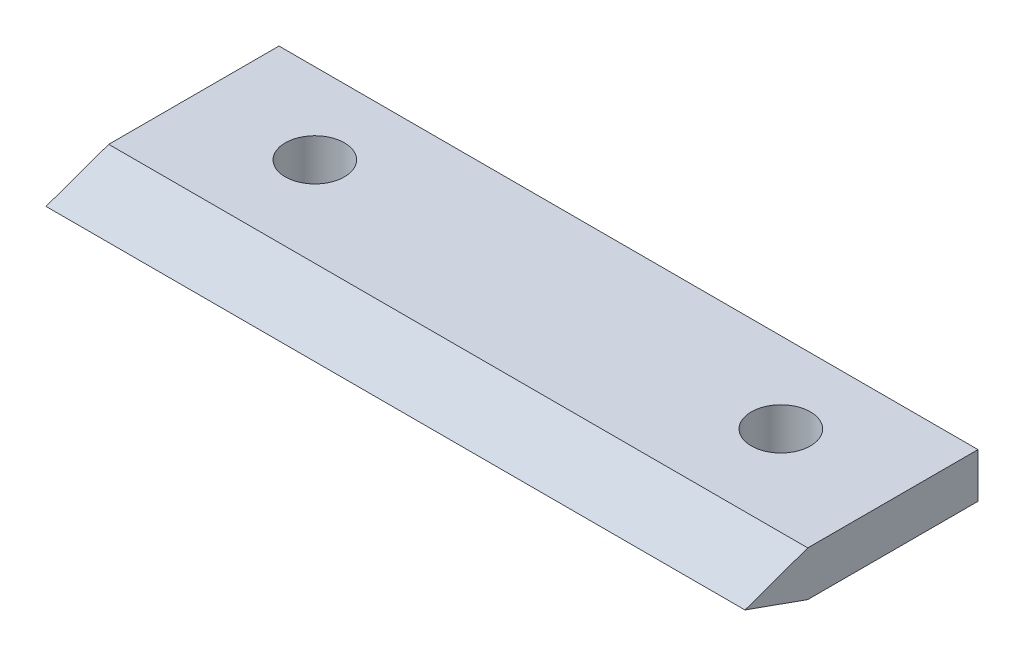
from build123d import *

# Parameters (mm, degrees)
SKETCH_1_W          = 39
SKETCH_1_H          = 13
SKETCH_1_R          = 1.65
EXTRUDE_1_DEPTH     = 2.5
CUT_EXTRUDE_1_DEPTH = 42
CUT_EXTRUDE_2_DEPTH = 42


with BuildPart() as part:
    # 草图1 → 凸台-拉伸1 (new body)
    with BuildSketch(Plane(origin=(0, 0, 0), x_dir=(1, 0, 0), z_dir=(0, 1, 0))):
        with Locations((19.5, 6.5)):
            Rectangle(SKETCH_1_W, SKETCH_1_H)
        with Locations(Location((6.5, 8.5, 0), (0, 0, 270))):
            Circle(SKETCH_1_R, mode=Mode.SUBTRACT)
        with Locations(Location((32.5, 8.5, 0), (0, 0, 270))):
            Circle(SKETCH_1_R, mode=Mode.SUBTRACT)
    extrude(amount=EXTRUDE_1_DEPTH)

    # 草图2 → 切除-拉伸1 (cut)
    with BuildSketch(Plane(origin=(39, 0, 0), x_dir=(0, 0, -1), z_dir=(1, 0, 0))):
        Polygon((3.5, 2.5), (0, 2.5), (0, 1.25), align=None)
    extrude(amount=-CUT_EXTRUDE_1_DEPTH, mode=Mode.SUBTRACT)

    # 草图3 → 切除-拉伸2 (cut)
    with BuildSketch(Plane(origin=(39, 0, 0), x_dir=(0, 0, -1), z_dir=(1, 0, 0))):
        Polygon((0, 1.25), (0, 0), (3.5, 0), align=None)
    extrude(amount=-CUT_EXTRUDE_2_DEPTH, mode=Mode.SUBTRACT)


solid = part.part
